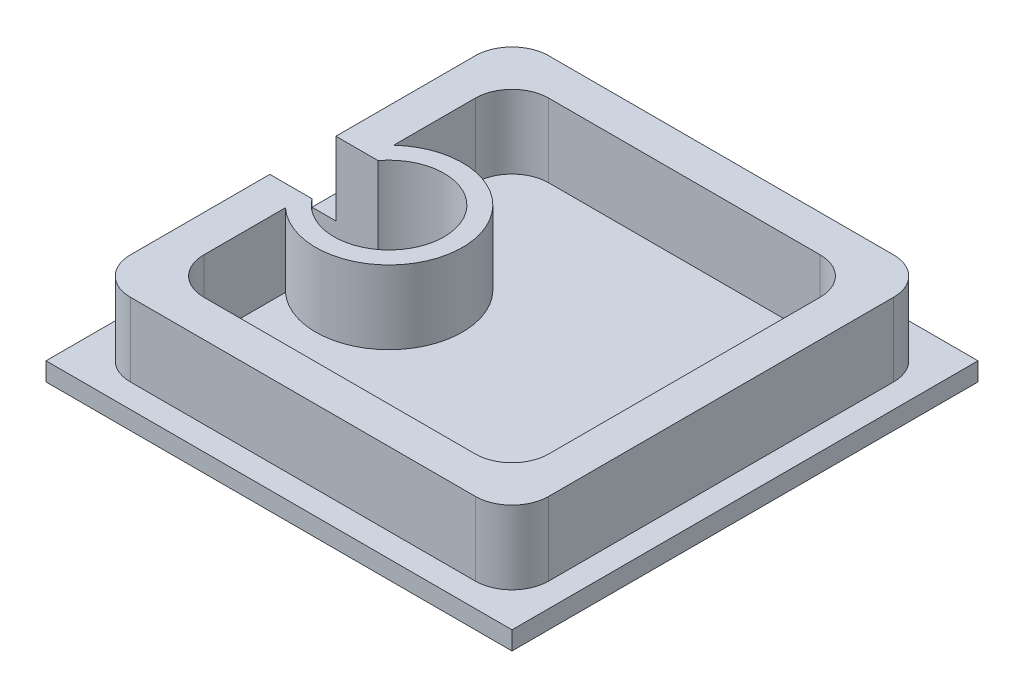
from build123d import *

# Parameters (mm, degrees)
SKETCH1_W           = 25.4
SKETCH1_H           = 25.4
BOSS_EXTRUDE1_DEPTH = 1
SKETCH2_W           = 22.8
SKETCH2_H           = 22.8
SKETCH2_W_2         = 18.8
SKETCH2_H_2         = 18.8
BOSS_EXTRUDE2_DEPTH = 4
FILLET1_R           = 2
SKETCH3_W           = 1.3
SKETCH3_H           = 3.6
CUT_EXTRUDE1_DEPTH  = 19.643497526
BOSS_EXTRUDE3_START = 4
BOSS_EXTRUDE3_DEPTH = 4


with BuildPart() as part:
    # Sketch1 → Boss-Extrude1 (new body)
    with BuildSketch(Plane(origin=(0, 0, 0), x_dir=(1, 0, 0), z_dir=(0, 1, 0))):
        Rectangle(SKETCH1_W, SKETCH1_H)
    extrude(amount=BOSS_EXTRUDE1_DEPTH)

    # Sketch2 → Boss-Extrude2 (add)
    with BuildSketch(Plane(origin=(0, 1, 0), x_dir=(1, 0, 0), z_dir=(0, 1, 0))):
        Rectangle(SKETCH2_W, SKETCH2_H)
        Rectangle(SKETCH2_W_2, SKETCH2_H_2, mode=Mode.SUBTRACT)
    extrude(amount=BOSS_EXTRUDE2_DEPTH)

    # Fillet1
    fillet1_edges = [part.edges().sort_by_distance(p)[0] for p in [
        (11.4, 3, 11.4),
        (11.4, 3, -11.4),
        (-11.4, 3, -11.4),
        (-11.4, 3, 11.4),
        (-9.4, 3, -9.4),
        (-9.4, 3, 9.4),
        (9.4, 3, 9.4),
        (9.4, 3, -9.4),
    ]]
    fillet(fillet1_edges, radius=FILLET1_R)

    # Sketch3 → Cut-Extrude1 (cut, through all)
    with BuildSketch(Plane(origin=(0, 5, 0), x_dir=(1, 0, 0), z_dir=(0, 1, 0))):
        with BuildLine():
            Line((-6.7, 1.8), (-9.1, 1.8))
            ThreePointArc((-9.1, 1.8), (-9.261854267, 1.561058204), (-9.4, 1.307669683))
            Line((-9.4, 1.307669683), (-9.4, -1.307669683))
            ThreePointArc((-9.4, -1.307669683), (-9.261854267, -1.561058204), (-9.1, -1.8))
            Line((-9.1, -1.8), (-6.7, -1.8))
            Line((-6.7, -1.8), (-6.7, 1.8))
        make_face()
        with Locations((-12.05, 0)):
            Rectangle(SKETCH3_W, SKETCH3_H)
        with BuildLine():
            Line((-9.4, 1.8), (-11.4, 1.8))
            Line((-11.4, 1.8), (-11.4, -1.8))
            Line((-11.4, -1.8), (-9.4, -1.8))
            Line((-9.4, -1.8), (-9.4, -1.307669683))
            ThreePointArc((-9.4, -1.307669683), (-9.7, 0), (-9.4, 1.307669683))
            Line((-9.4, 1.307669683), (-9.4, 1.8))
        make_face()
        with BuildLine():
            ThreePointArc((-3.7, 0), (-5.751316702, 2.846049894), (-9.1, 1.8))
            Line((-9.1, 1.8), (-6.7, 1.8))
            Line((-6.7, 1.8), (-6.7, -1.8))
            Line((-6.7, -1.8), (-9.1, -1.8))
            ThreePointArc((-9.1, -1.8), (-5.751316702, -2.846049894), (-3.7, 0))
        make_face()
        with BuildLine():
            Line((-9.1, 1.8), (-9.4, 1.8))
            Line((-9.4, 1.8), (-9.4, 1.307669683))
            ThreePointArc((-9.4, 1.307669683), (-9.261854267, 1.561058204), (-9.1, 1.8))
        make_face()
        with BuildLine():
            Line((-9.4, -1.307669683), (-9.4, 1.307669683))
            ThreePointArc((-9.4, 1.307669683), (-9.7, 0), (-9.4, -1.307669683))
        make_face()
        with BuildLine():
            Line((-9.4, -1.307669683), (-9.4, -1.8))
            Line((-9.4, -1.8), (-9.1, -1.8))
            ThreePointArc((-9.1, -1.8), (-9.261854267, -1.561058204), (-9.4, -1.307669683))
        make_face()
    extrude(amount=-CUT_EXTRUDE1_DEPTH, mode=Mode.SUBTRACT)

    # Sketch4 → Boss-Extrude3 (add)
    with BuildSketch(Plane(origin=(0, 1, 0), x_dir=(1, 0, 0), z_dir=(0, 1, 0)).offset(BOSS_EXTRUDE3_START)):
        with BuildLine():
            Line((-9.1, 1.8), (-9.4, 1.8))
            Line((-9.4, 1.8), (-9.4, 2.951270913))
            ThreePointArc((-9.4, 2.951270913), (-2.7, 0), (-9.4, -2.951270913))
            Line((-9.4, -2.951270913), (-9.4, -1.8))
            Line((-9.4, -1.8), (-9.1, -1.8))
            ThreePointArc((-9.1, -1.8), (-3.7, 0), (-9.1, 1.8))
        make_face()
    extrude(amount=-BOSS_EXTRUDE3_DEPTH)


solid = part.part
